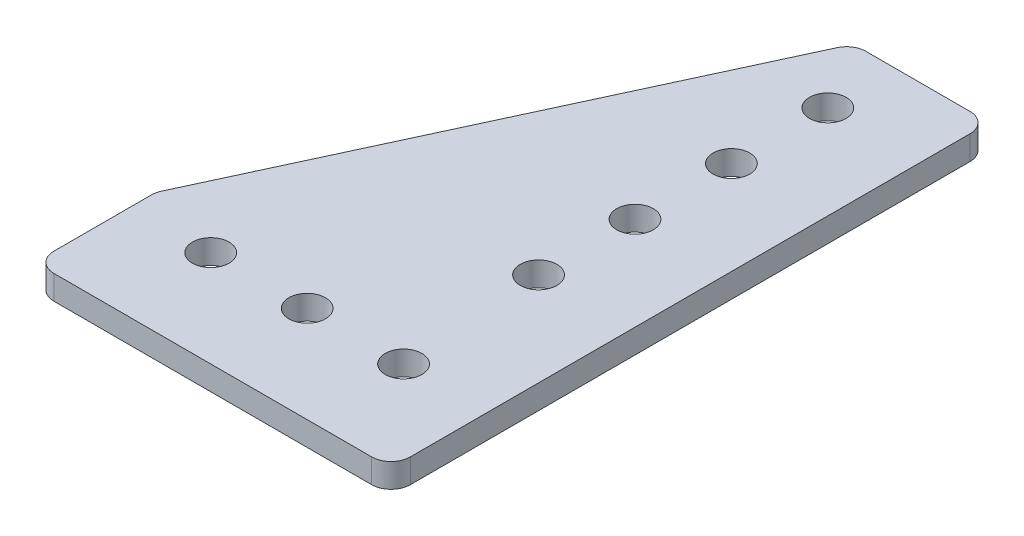
from build123d import *

# Parameters (mm, degrees)
SKETCH1_W           = 50.8
SKETCH1_H           = 82.55
BOSS_EXTRUDE1_DEPTH = 3.175
SKETCH2_R           = 2.413
CUT_EXTRUDE1_DEPTH  = 97.980529618
CUT_EXTRUDE2_DEPTH  = 97.980529618
FILLET1_R           = 2.54


with BuildPart() as part:
    # Sketch1 → Boss-Extrude1 (new body)
    with BuildSketch(Plane(origin=(0, 0, 0), x_dir=(1, 0, 0), z_dir=(0, 1, 0))):
        with Locations((25.4, 41.275)):
            Rectangle(SKETCH1_W, SKETCH1_H)
    extrude(amount=BOSS_EXTRUDE1_DEPTH)

    # Sketch2 → Cut-Extrude1 (cut, through all)
    with BuildSketch(Plane(origin=(0, 3.175, 0), x_dir=(1, 0, 0), z_dir=(0, 1, 0))):
        with Locations(Location((39.752682174, 12.7, 0), (0, 0, 270))):
            Circle(SKETCH2_R)
        with Locations(Location((27.052682174, 12.7, 0), (0, 0, 270))):
            Circle(SKETCH2_R)
        with Locations(Location((14.352682174, 12.7, 0), (0, 0, 270))):
            Circle(SKETCH2_R)
        with Locations(Location((38.482682174, 31.75, 0), (0, 0, 270))):
            Circle(SKETCH2_R)
        with Locations(Location((38.482682174, 44.45, 0), (0, 0, 270))):
            Circle(SKETCH2_R)
        with Locations(Location((38.482682174, 57.15, 0), (0, 0, 270))):
            Circle(SKETCH2_R)
        with Locations(Location((38.482682174, 69.85, 0), (0, 0, 270))):
            Circle(SKETCH2_R)
    extrude(amount=-CUT_EXTRUDE1_DEPTH, mode=Mode.SUBTRACT)

    # Sketch3 → Cut-Extrude2 (cut, through all)
    with BuildSketch(Plane(origin=(0, 3.175, 0), x_dir=(1, 0, 0), z_dir=(0, 1, 0))):
        Polygon((3.859765226, 0), (3.859765226, 15.946793053), (32.906889952, 78.808591348), (50.8, 78.808591348), (50.8, 82.55), (0, 82.55), (0, 0), align=None)
    extrude(amount=-CUT_EXTRUDE2_DEPTH, mode=Mode.SUBTRACT)

    # Fillet1
    fillet1_edges = [part.edges().sort_by_distance(p)[0] for p in [
        (3.859765226, 1.5875, 0),
        (50.8, 1.5875, -78.808591348),
        (32.906889952, 1.5875, -78.808591348),
        (3.859765226, 1.5875, -15.946793053),
        (50.8, 1.5875, 0),
    ]]
    fillet(fillet1_edges, radius=FILLET1_R)


solid = part.part
